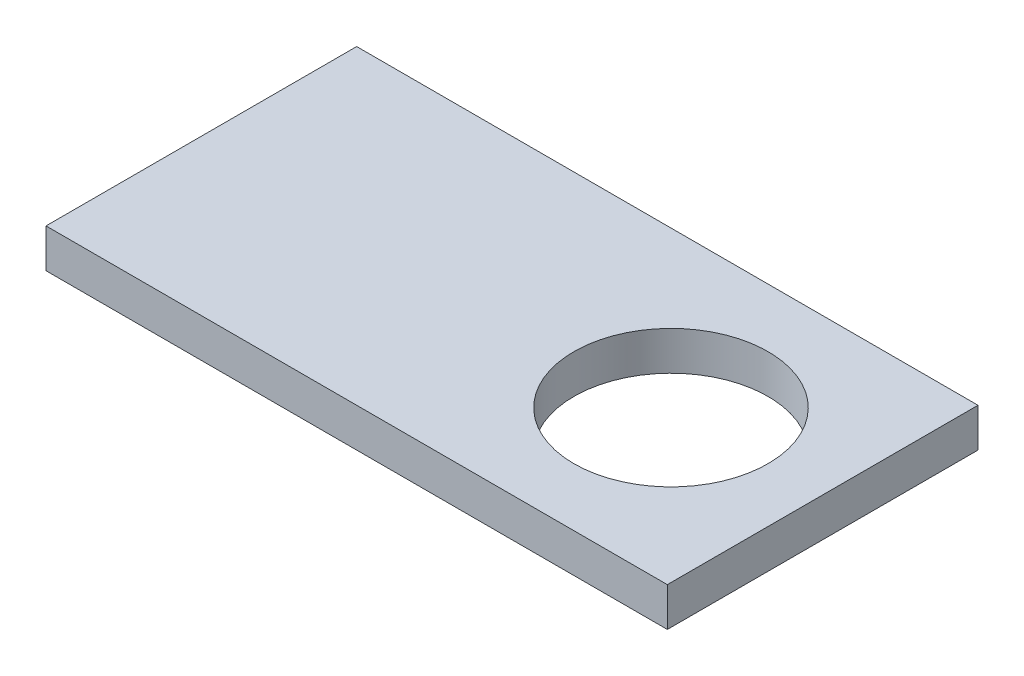
from build123d import *

# Parameters (mm, degrees)
SKETCH1_W           = 40.64
SKETCH1_H           = 20.32
SKETCH1_R           = 6.35
BOSS_EXTRUDE1_DEPTH = 2.54


with BuildPart() as part:
    # Sketch1 → Boss-Extrude1 (new body)
    with BuildSketch(Plane(origin=(0, 0, 0), x_dir=(1, 0, 0), z_dir=(0, 1, 0))):
        with Locations((20.32, 10.16)):
            Rectangle(SKETCH1_W, SKETCH1_H)
        with Locations(Location((30.734, 10.144013824, 0), (0, 0, 270))):
            Circle(SKETCH1_R, mode=Mode.SUBTRACT)
    extrude(amount=BOSS_EXTRUDE1_DEPTH)


solid = part.part
